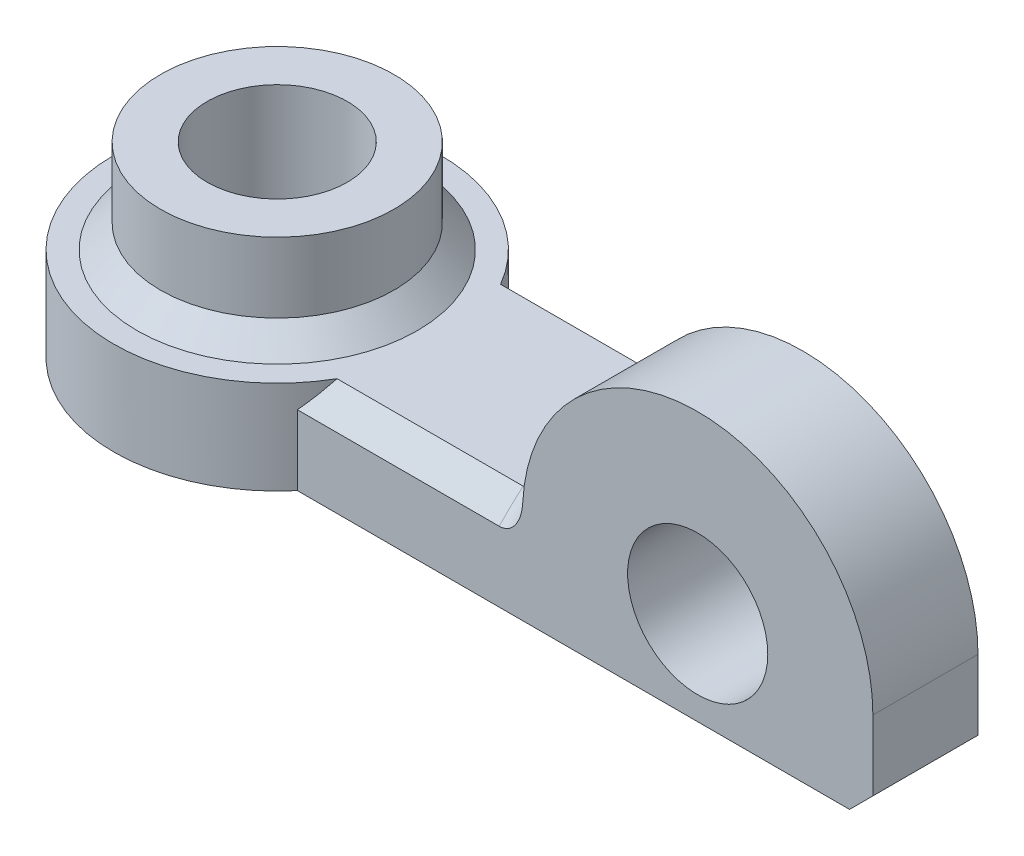
from build123d import *

# Parameters (mm, degrees)
SKETCH1_R           = 5
BOSS_EXTRUDE1_DEPTH = 4
SKETCH1_3_R         = 5
SKETCH1_3_R_2       = 3
BOSS_EXTRUDE2_DEPTH = 8
SKETCH2_R           = 3
BOSS_EXTRUDE3_DEPTH = 4.5
CUT_EXTRUDE1_START  = -4.5
SKETCH3_R           = 3
CUT_EXTRUDE1_DEPTH  = 4.5
CHAMFER1_SIZE       = 1
FILLET1_R           = 1


with BuildPart() as part:
    # Sketch1 → Boss-Extrude1 (new body)
    with BuildSketch(Plane(origin=(0, 0, 0), x_dir=(1, 0, 0), z_dir=(0, 1, 0))):
        with BuildLine():
            Line((15, 0), (15, 4.5))
            Line((15, 4.5), (5.361902647, 4.5))
            ThreePointArc((5.361902647, 4.5), (-7, 0), (5.361902647, -4.5))
            Line((5.361902647, -4.5), (30, -4.5))
            Line((30, -4.5), (30, 0))
            Line((30, 0), (15, 0))
        make_face()
        Circle(SKETCH1_R, mode=Mode.SUBTRACT)
    extrude(amount=BOSS_EXTRUDE1_DEPTH)

    # Sketch1<3> → Boss-Extrude2 (add)
    with BuildSketch(Plane(origin=(0, 0, 0), x_dir=(1, 0, 0), z_dir=(0, 1, 0))):
        Circle(SKETCH1_3_R)
        Circle(SKETCH1_3_R_2, mode=Mode.SUBTRACT)
    extrude(amount=BOSS_EXTRUDE2_DEPTH)

    # Sketch2 → Boss-Extrude3 (add)
    with BuildSketch(Plane.XY):
        with BuildLine():
            Line((15, 4), (15, 0))
            Line((15, 0), (30, 0))
            Line((30, 0), (30, 4))
            ThreePointArc((30, 4), (22.5, 11.5), (15, 4))
        make_face()
        with Locations((22.5, 4)):
            Circle(SKETCH2_R, mode=Mode.SUBTRACT)
    extrude(amount=BOSS_EXTRUDE3_DEPTH)

    # Sketch3 → Cut-Extrude1 (cut)
    with BuildSketch(Plane.XY.offset(4.5).offset(CUT_EXTRUDE1_START)):
        with Locations((22.5, 4)):
            Circle(SKETCH3_R)
    extrude(amount=CUT_EXTRUDE1_DEPTH, mode=Mode.SUBTRACT)

    # Chamfer1
    chamfer1_edges = [part.edges().sort_by_distance(p)[0] for p in [
        (-5, 4, 0),
        (30, 0, 2.25),
        (10.180951324, 4, 4.5),
        (10.180951324, 0, -4.5),
        (10.180951324, 4, -4.5),
        (15, 2, -4.5),
    ]]
    chamfer(chamfer1_edges, length=CHAMFER1_SIZE)

    # Fillet1
    fillet1_edges = [part.edges().sort_by_distance(p)[0] for p in [
        (15.016722764, 3.499438512, 4.000561488),
        (15, 4, 1.75),
    ]]
    fillet(fillet1_edges, radius=FILLET1_R)


solid = part.part
